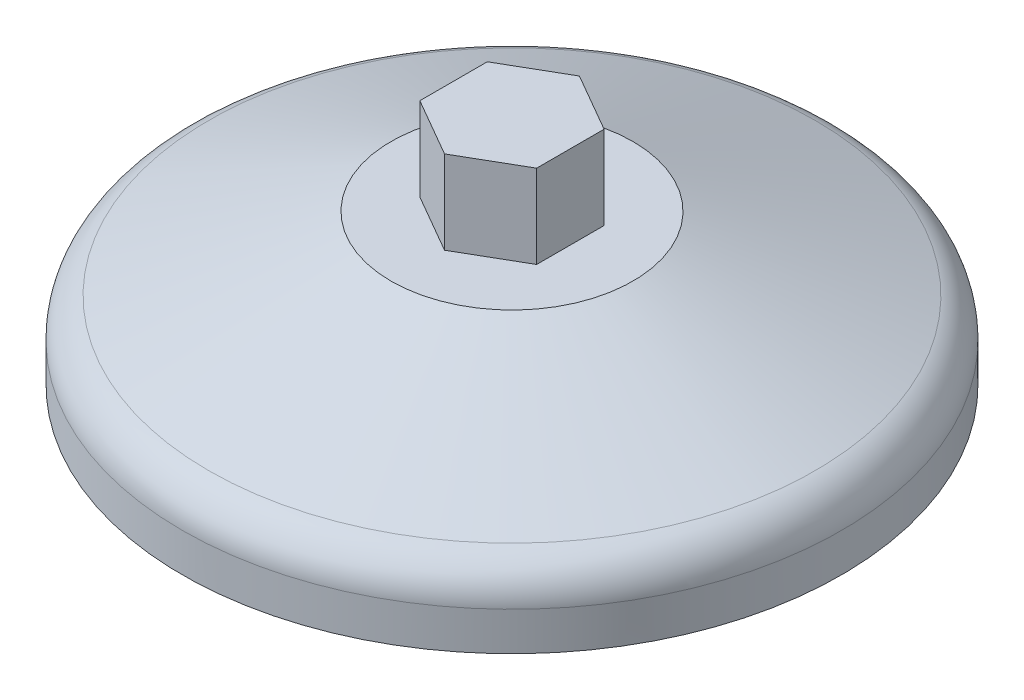
from build123d import *

# Parameters (mm, degrees)
BOSS_EXTRUDE1_DEPTH = 10
FILLET1_R           = 5


with BuildPart() as part:
    # Sketch1 → Revolve1 (revolve)
    with BuildSketch(Plane.XY.offset(-4.960131955), mode=Mode.PRIVATE) as revolve1_sk:
        Polygon((-40.67747299, -48.555428355), (-55.17747299, -48.555428355), (-55.17747299, -66.555428355), (-15.67747299, -66.555428355), (-15.67747299, -58.555428355), align=None)
    revolve(revolve1_sk.sketch.rotate(Axis((-55.17747299, -48.555428355, -4.960131955), (0, -1, 0)), 270), axis=Axis((-55.17747299, -48.555428355, -4.960131955), (0, -1, 0)))

    # Sketch2 → Boss-Extrude1 (add)
    with BuildSketch(Plane(origin=(0, -48.555428355, 0), x_dir=(-1, 0, 0), z_dir=(0, 1, 0))):
        Polygon((55.17747299, 3.122771813), (62.17747299, -0.918680071), (62.17747299, -9.00158384), (55.17747299, -13.043035724), (48.17747299, -9.00158384), (48.17747299, -0.918680071), align=None)
    extrude(amount=BOSS_EXTRUDE1_DEPTH)

    # Fillet1
    fillet1_edges = [part.edges().sort_by_distance(p)[0] for p in [
        (-55.17747299, -58.555428355, 34.539868045),
    ]]
    fillet(fillet1_edges, radius=FILLET1_R)


solid = part.part
